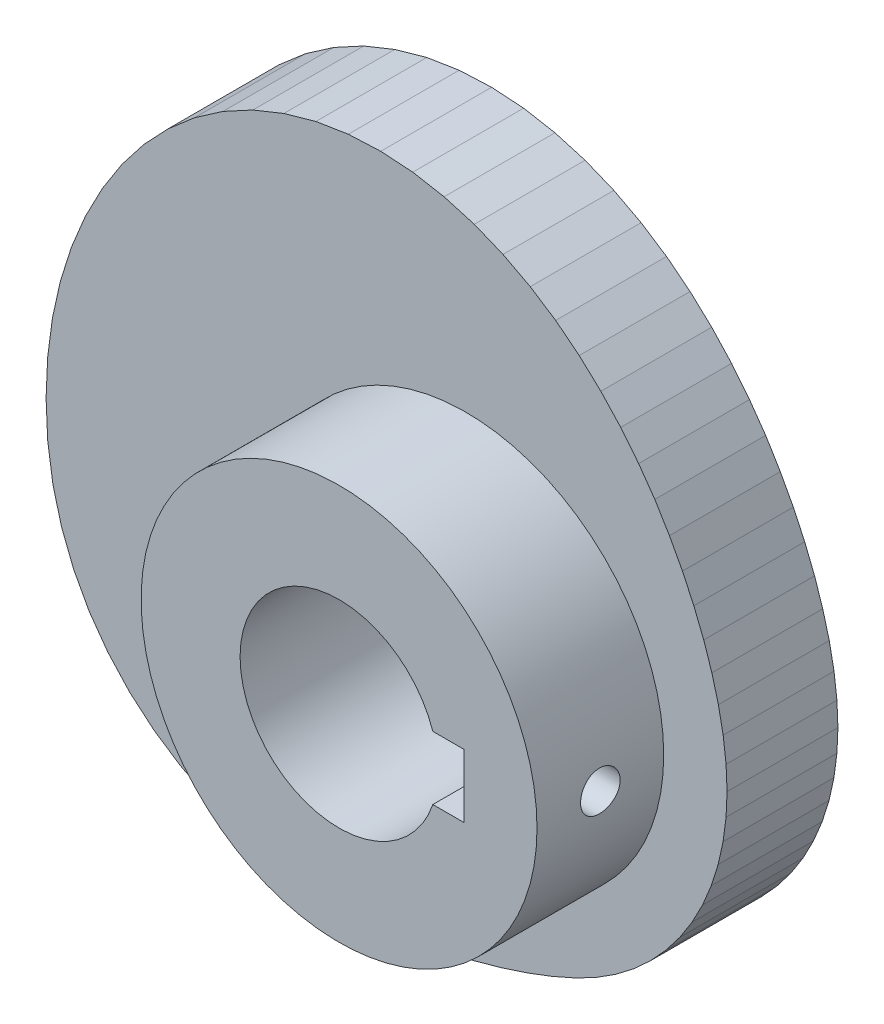
from build123d import *

# Parameters (mm, degrees)
EXTRUDE_1_DEPTH     = 14
SKETCH_2_R          = 25
EXTRUDE_2_DEPTH     = 30
SKETCH_3_R          = 12.5
CUT_EXTRUDE_1_DEPTH = 78.638957463
SKETCH_4_W          = 15.8
SKETCH_4_H          = 8
CUT_EXTRUDE_2_DEPTH = 78.638957463
SKETCH_5_R          = 2.5
CUT_EXTRUDE_3_DEPTH = 12.6


with BuildPart() as part:
    # 草图1 → 凸台-拉伸1 (new body)
    with BuildSketch(Plane.XY):
        Polygon((33, 0), (32.877, 2.92), (32.509, 5.918), (31.905, 8.957), (31.082, 12.024), (30.05, 15.108), (28.805, 18.217), (27.368, 21.287), (25.721, 24.347), (23.877, 27.39), (21.833, 30.286), (19.566, 33.114), (17.058, 35.81), (14.33, 38.353), (11.355, 40.699), (8.143, 42.787), (4.705, 44.597), (1.07, 46.077), (-2.738, 47.178), (-6.695, 47.891), (-10.736, 48.154), (-14.831, 47.972), (-18.921, 47.32), (-22.957, 46.182), (-26.882, 44.596), (-30.655, 42.555), (-34.232, 40.082), (-37.587, 37.188), (-40.651, 33.948), (-43.421, 30.382), (-45.899, 26.5), (-48.034, 22.4), (-49.804, 18.127), (-51.194, 13.717), (-52.195, 9.203), (-52.798, 4.619), (-53, 0), (-52.792, -4.538), (-52.138, -8.965), (-51.069, -13.013), (-49.531, -16.93), (-47.557, -20.575), (-45.185, -23.874), (-42.441, -26.865), (-39.386, -29.472), (-36.063, -31.683), (-32.551, -33.456), (-28.863, -34.852), (-25.036, -35.873), (-21.187, -36.513), (-17.358, -36.81), (-13.57, -36.793), (-9.807, -36.517), (-6.123, -36.017), (-2.511, -35.329), (1.018, -34.495), (4.452, -33.532), (7.819, -32.438), (10.907, -31.265), (13.89, -29.95), (16.5, -28.579), (18.928, -27.032), (21.212, -25.279), (23.335, -23.335), (25.279, -21.212), (27.032, -18.928), (28.579, -16.5), (29.908, -13.946), (31.01, -11.287), (31.876, -8.541), (32.499, -5.73), (32.874, -2.876), align=None)
    extrude(amount=EXTRUDE_1_DEPTH)

    # 草图2 → 凸台-拉伸2 (add)
    with BuildSketch(Plane.XY):
        Circle(SKETCH_2_R)
    extrude(amount=EXTRUDE_2_DEPTH)

    # 草图3 → 切除-拉伸1 (cut, through all)
    with BuildSketch(Plane.XY):
        Circle(SKETCH_3_R)
    extrude(amount=CUT_EXTRUDE_1_DEPTH, mode=Mode.SUBTRACT)

    # 草图4 → 切除-拉伸2 (cut, through all)
    with BuildSketch(Plane.XY):
        with Locations((7.9, 0)):
            Rectangle(SKETCH_4_W, SKETCH_4_H)
    extrude(amount=CUT_EXTRUDE_2_DEPTH, mode=Mode.SUBTRACT)

    # 草图5 → 切除-拉伸3 (cut)
    with BuildSketch(Plane(origin=(25, 0, 0), x_dir=(0, 0, -1), z_dir=(1, 0, 0))):
        with Locations(Location((-22, 0, 0), (0, 0, 180))):
            Circle(SKETCH_5_R)
    extrude(amount=-CUT_EXTRUDE_3_DEPTH, mode=Mode.SUBTRACT)


solid = part.part
